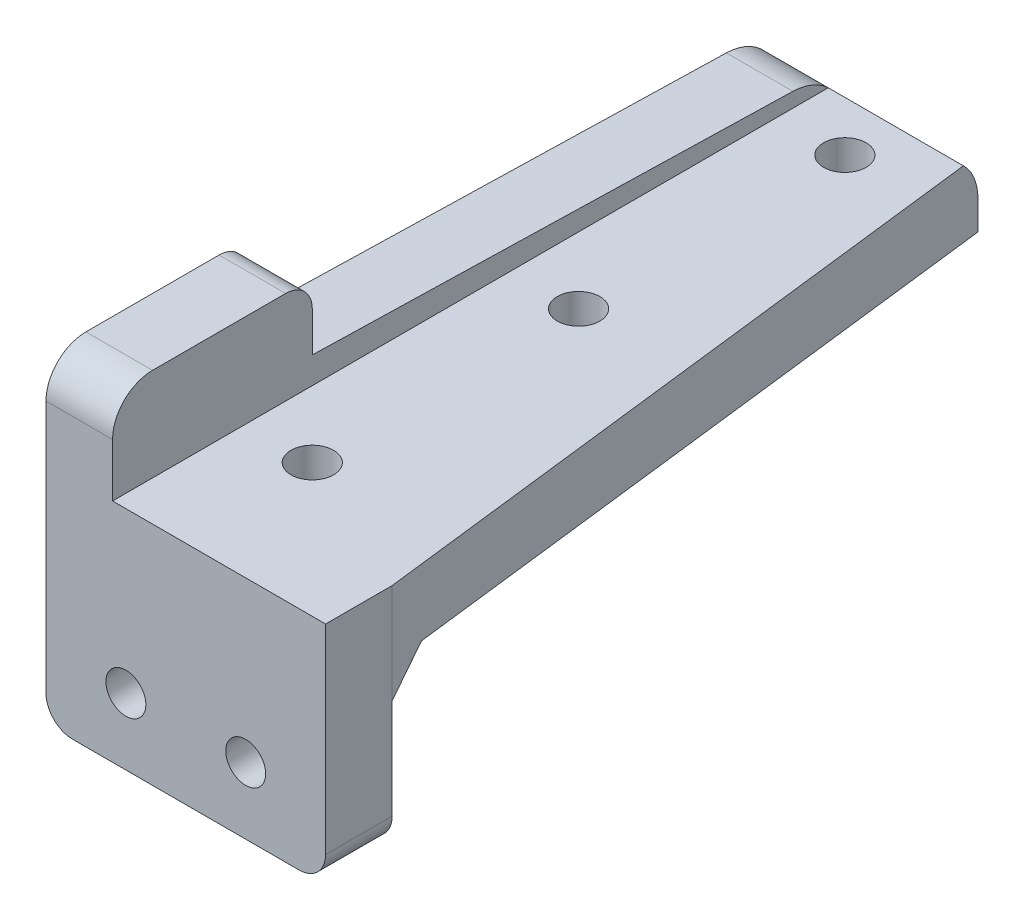
from build123d import *

# Parameters (mm, degrees)
SKETCH_1_W          = 15
SKETCH_1_H          = 50
EXTRUDE_1_DEPTH     = 5
EXTRUDE_2_DEPTH     = 5
FILLET_1_R          = 4
FILLET_3_R          = 2
SKETCH_5_R          = 1.6
CUT_EXTRUDE_1_DEPTH = 5
SKETCH_7_R          = 1.5
EXTRUDE_3_DEPTH     = 5
CHAMFER_1_SIZE      = 2.5
FILLET_8_R          = 3
EXTRUDE_4_DEPTH     = 3
FILLET_9_R          = 2


with BuildPart() as part:
    # 草图1 → 凸台-拉伸1 (new body)
    with BuildSketch(Plane(origin=(0, 0, 0), x_dir=(1, 0, 0), z_dir=(0, 1, 0))):
        Rectangle(SKETCH_1_W, SKETCH_1_H)
        Polygon((13.5, -25), (7.5, -25), (7.5, 25), align=None)
    extrude(amount=EXTRUDE_1_DEPTH)

    # 草图4 → 凸台-拉伸2 (add)
    with BuildSketch(Plane.ZY.offset(7.5)):
        Polygon((-25, 6), (-25, 5), (25, 5), (25, 12), (15, 12), (15, 7), align=None)
    extrude(amount=-EXTRUDE_2_DEPTH)

    # 圆角1
    fillet_1_edges = [part.edges().sort_by_distance(p)[0] for p in [
        (-5, 6, -25),
    ]]
    fillet(fillet_1_edges, radius=FILLET_1_R)

    # 圆角3
    fillet_3_edges = [part.edges().sort_by_distance(p)[0] for p in [
        (-5, 12, 15),
    ]]
    fillet(fillet_3_edges, radius=FILLET_3_R)

    # 草图5 → 切除-拉伸1 (cut)
    with BuildSketch(Plane(origin=(0, 5, 0), x_dir=(1, 0, 0), z_dir=(0, 1, 0))):
        with Locations(Location((2.5, 20, 0), (0, 0, 270))):
            Circle(SKETCH_5_R)
        with Locations(Location((2.5, 0, 0), (0, 0, 270))):
            Circle(SKETCH_5_R)
        with Locations(Location((2.5, -20, 0), (0, 0, 270))):
            Circle(SKETCH_5_R)
    extrude(amount=-CUT_EXTRUDE_1_DEPTH, mode=Mode.SUBTRACT)

    # 草图7 → 凸台-拉伸3 (add)
    with BuildSketch(Plane.XY.offset(25)):
        Polygon((13.5, 0), (13.5, 5), (-2.5, 5), (-2.5, 12), (-7.5, 12), (-7.5, 0), (-7.5, -12), (13.5, -12), align=None)
        with Locations((-1.5, -7)):
            Circle(SKETCH_7_R, mode=Mode.SUBTRACT)
        with Locations((7.5, -7)):
            Circle(SKETCH_7_R, mode=Mode.SUBTRACT)
    extrude(amount=EXTRUDE_3_DEPTH)

    # 倒角1
    chamfer_1_edges = [part.edges().sort_by_distance(p)[0] for p in [
        (3, 0, 25),
    ]]
    chamfer(chamfer_1_edges, length=CHAMFER_1_SIZE)

    # 圆角8
    fillet_8_edges = [part.edges().sort_by_distance(p)[0] for p in [
        (-5, 12, 30),
    ]]
    fillet(fillet_8_edges, radius=FILLET_8_R)

    # 草图8 → 凸台-拉伸4 (add)
    with BuildSketch(Plane.ZY.offset(7.5)):
        Polygon((25, -12), (25, -2.5), (22.5, 0), (-7.5, 0), align=None)
    extrude(amount=-EXTRUDE_4_DEPTH)

    # 圆角9
    fillet_9_edges = [part.edges().sort_by_distance(p)[0] for p in [
        (13.5, -12, 27.5),
        (-7.5, -12, 27.5),
    ]]
    fillet(fillet_9_edges, radius=FILLET_9_R)


solid = part.part
